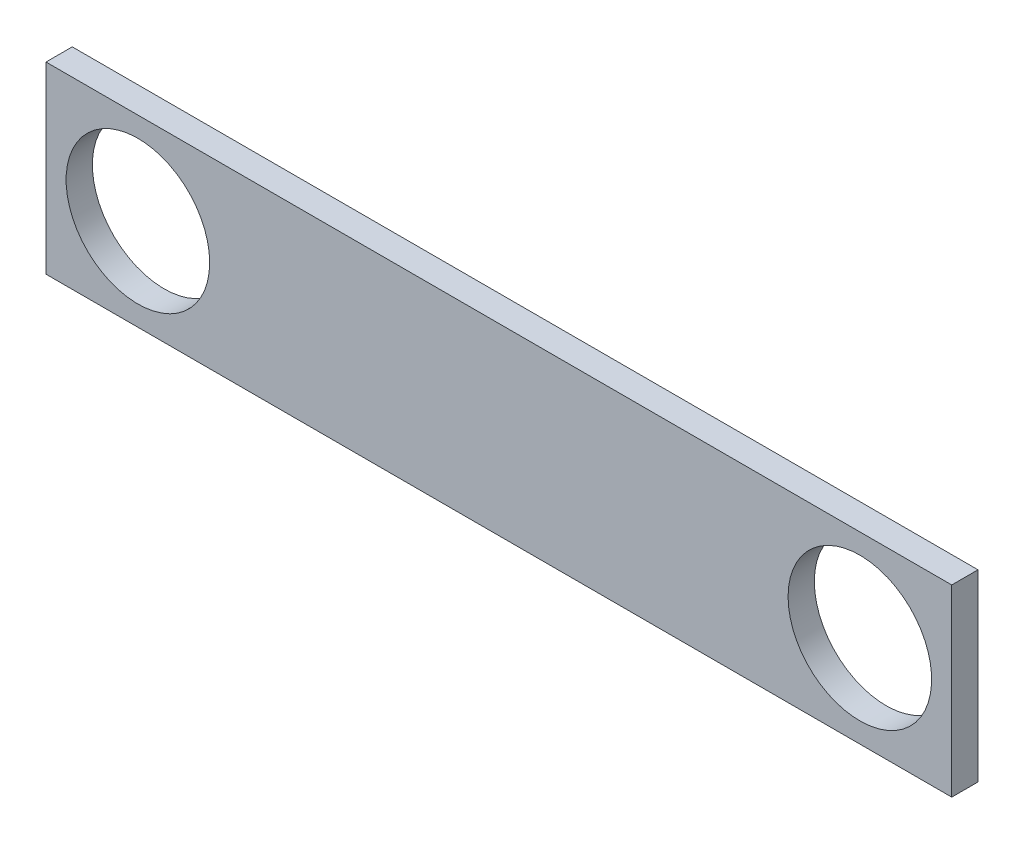
from build123d import *

# Parameters (mm, degrees)
SKETCH1_W           = 69
SKETCH1_H           = 14
SKETCH1_R           = 5.46828662
BOSS_EXTRUDE1_DEPTH = 2


with BuildPart() as part:
    # Sketch1 → Boss-Extrude1 (new body)
    with BuildSketch(Plane.XY):
        Rectangle(SKETCH1_W, SKETCH1_H)
        with Locations((-27.5, 0)):
            Circle(SKETCH1_R, mode=Mode.SUBTRACT)
        with Locations(Location((27.5, 0, 0), (0, 0, 180))):
            Circle(SKETCH1_R, mode=Mode.SUBTRACT)
    extrude(amount=BOSS_EXTRUDE1_DEPTH)


solid = part.part
